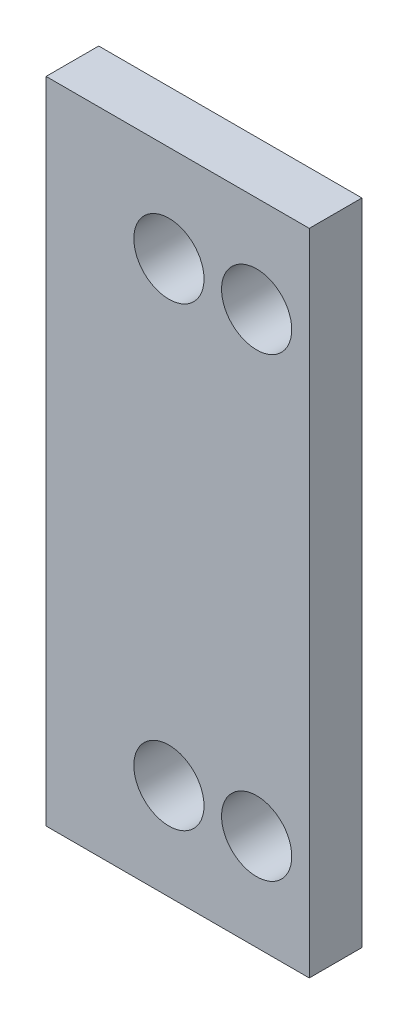
from build123d import *

# Parameters (mm, degrees)
ESBO_O1_R                = 2
RESSALTO_EXTRUS_O2_DEPTH = 3


with BuildPart() as part:
    # Esboço1 → Ressalto-extrusão2 (new body)
    with BuildSketch(Plane.XY):
        Polygon((-6.112990177, 5.471327808), (-6.112990177, 23.971327808), (1.387009823, 23.971327808), (8.887009823, 23.971327808), (8.887009823, 5.471327808), (8.887009823, -13.028672192), (1.387009823, -13.028672192), (-6.112990177, -13.028672192), align=None)
        with Locations((0.887009823, 18.471327808)):
            Circle(ESBO_O1_R, mode=Mode.SUBTRACT)
        with Locations((5.887009823, 18.471327808)):
            Circle(ESBO_O1_R, mode=Mode.SUBTRACT)
        with Locations((0.887009823, -7.528672192)):
            Circle(ESBO_O1_R, mode=Mode.SUBTRACT)
        with Locations((5.887009823, -7.528672192)):
            Circle(ESBO_O1_R, mode=Mode.SUBTRACT)
    extrude(amount=RESSALTO_EXTRUS_O2_DEPTH)


solid = part.part
